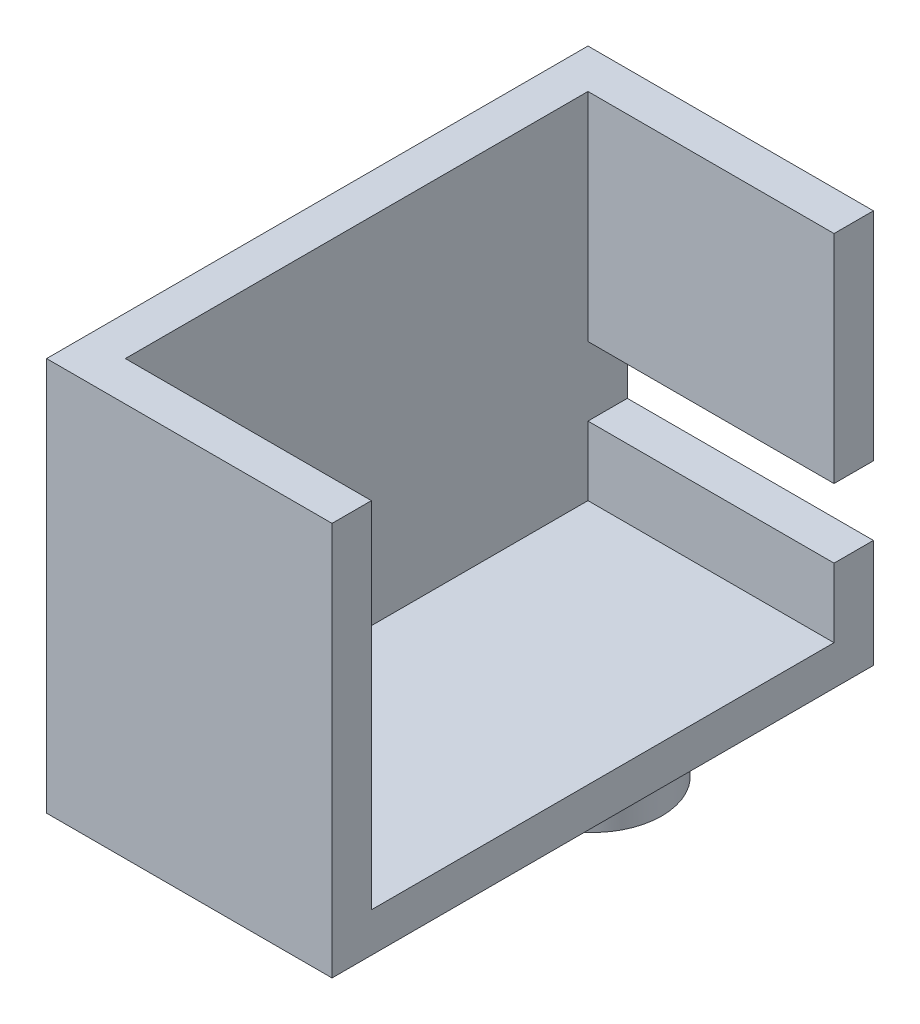
from build123d import *

# Parameters (mm, degrees)
SKETCH_2_W          = 23.5
SKETCH_2_H          = 18
EXTRUDE_1_DEPTH     = 12.5
SHELL_7_T           = 2
SKETCH_4_W          = 2
SKETCH_4_H          = 3.5
CUT_EXTRUDE_3_DEPTH = 35.734708866
SKETCH_8_W          = 14.567673111
SKETCH_8_H          = 27.5
CUT_EXTRUDE_5_DEPTH = 2
SKETCH_7_R          = 3.5
EXTRUDE_2_DEPTH     = 5


with BuildPart() as part:
    # Эскиз2 → Бобышка-Вытянуть1 (new body)
    with BuildSketch(Plane(origin=(0, 0, 0), x_dir=(0, 0, -1), z_dir=(1, 0, 0))):
        with Locations((-11.75, 9)):
            Rectangle(SKETCH_2_W, SKETCH_2_H)
    extrude(amount=EXTRUDE_1_DEPTH)

    # Оболочка7
    shell_7_openings = [part.faces().sort_by_distance(p)[0] for p in [
        (12.5, 9, 11.75),
    ]]
    offset(amount=SHELL_7_T, openings=shell_7_openings, kind=Kind.INTERSECTION)

    # Эскиз4 → Вырез-Вытянуть3 (cut, through all)
    with BuildSketch(Plane(origin=(0, 0, 0), x_dir=(0, 0, -1), z_dir=(1, 0, 0))):
        with Locations((1, 5.25)):
            Rectangle(SKETCH_4_W, SKETCH_4_H)
    extrude(amount=CUT_EXTRUDE_3_DEPTH, mode=Mode.SUBTRACT)

    # Эскиз8 → Вырез-Вытянуть5 (cut)
    with BuildSketch(Plane(origin=(0, 20, 0), x_dir=(1, 0, 0), z_dir=(0, 1, 0))):
        with Locations((5.283836556, -11.75)):
            Rectangle(SKETCH_8_W, SKETCH_8_H)
    extrude(amount=-CUT_EXTRUDE_5_DEPTH, mode=Mode.SUBTRACT)

    # Эскиз7 → Бобышка-Вытянуть2 (add)
    with BuildSketch(Plane.XZ.offset(2)):
        with Locations(Location((5.25, 5, 0), (0, 0, 90))):
            Circle(SKETCH_7_R)
    extrude(amount=EXTRUDE_2_DEPTH)


solid = part.part
